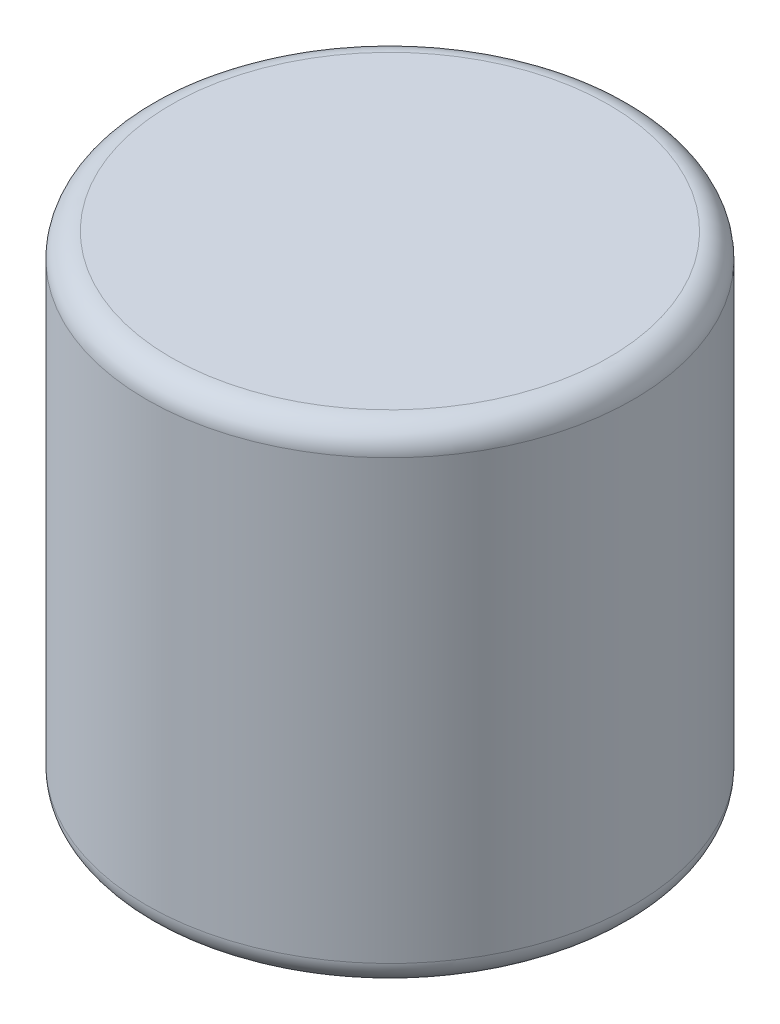
from build123d import *

# Parameters (mm, degrees)
SKETCH1_R           = 1
BOSS_EXTRUDE1_DEPTH = 2
FILLET1_R           = 0.1


with BuildPart() as part:
    # Sketch1 → Boss-Extrude1 (new body)
    with BuildSketch(Plane(origin=(0, 0, 0), x_dir=(1, 0, 0), z_dir=(0, 1, 0))):
        with Locations(Location((0, 0, 0), (0, 0, 270))):
            Circle(SKETCH1_R)
    extrude(amount=BOSS_EXTRUDE1_DEPTH)

    # Fillet1
    fillet1_edges = [part.edges().sort_by_distance(p)[0] for p in [
        (0, 0, -1),
        (0, 2, -1),
    ]]
    fillet(fillet1_edges, radius=FILLET1_R)


solid = part.part
